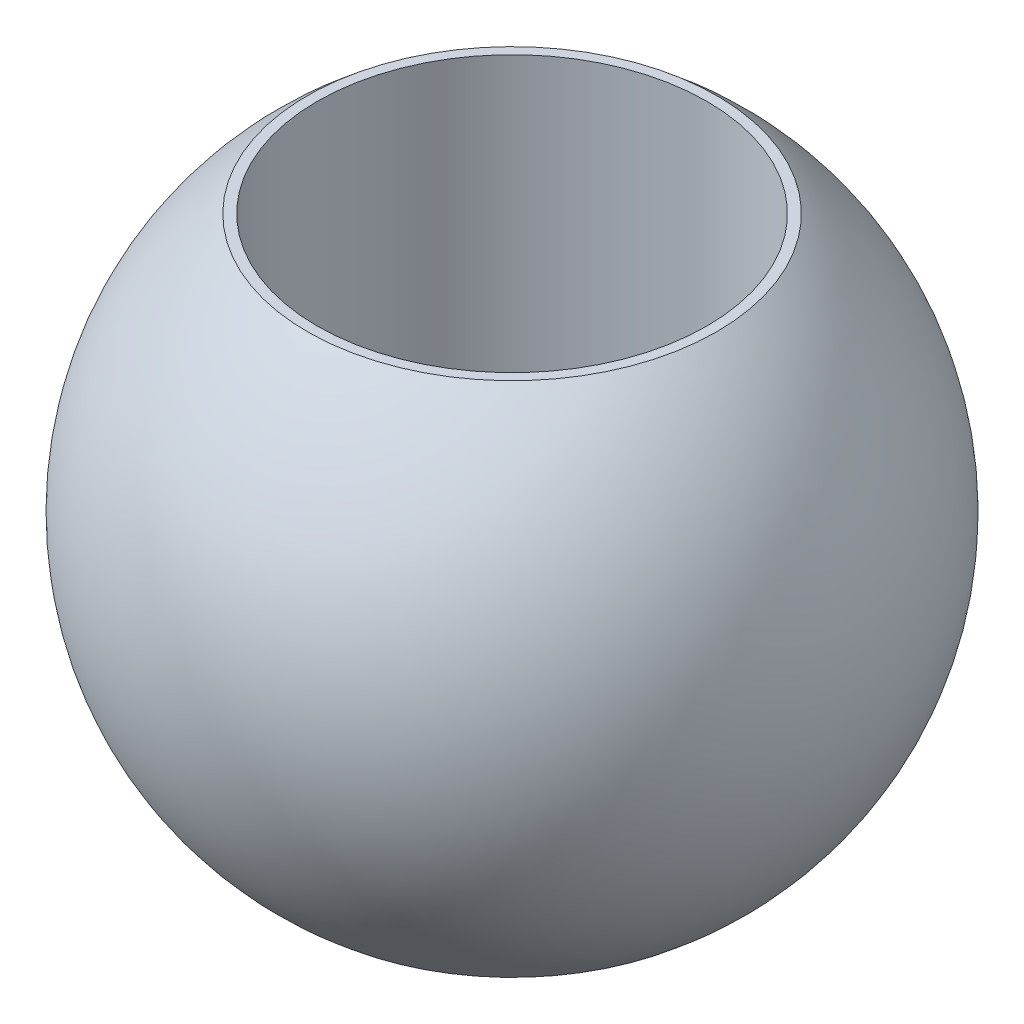
from build123d import *

# Parameters (mm, degrees)
CUT_EXTRUDE1_DEPTH      = 20.052558883
CUT_EXTRUDE1_DEPTH_BACK = 20.052558883
SKETCH2_R               = 6.5
CUT_EXTRUDE2_DEPTH      = 18.909494689
CUT_EXTRUDE2_DEPTH_BACK = 18.909494689
SKETCH3_W               = 22.753459083
SKETCH3_H               = 0.25
SKETCH3_W_2             = 23.945473889


with BuildPart() as part:
    # Sketch1 → Revolve1 (revolve)
    with BuildSketch(Plane.XY):
        with BuildLine():
            Line((0, 11), (0, -11))
            ThreePointArc((0, -11), (11, 0), (0, 11))
        make_face()
    revolve(axis=Axis((0, 11, 0), (0, -1, 0)))

    # Sketch2 → Cut-Extrude1 (cut, two sides: drawn at the far end of the back side and taken through both)
    with BuildSketch(Plane(origin=(0, 0, 0), x_dir=(1, 0, 0), z_dir=(0, 1, 0)).offset(-CUT_EXTRUDE1_DEPTH_BACK)):
        Circle(SKETCH2_R)
    extrude(amount=CUT_EXTRUDE1_DEPTH + CUT_EXTRUDE1_DEPTH_BACK, mode=Mode.SUBTRACT)

    # Sketch3 → Cut-Extrude2 (cut, two sides: drawn at the far end of the back side and taken through both)
    with BuildSketch(Plane.XY.offset(-CUT_EXTRUDE2_DEPTH_BACK)):
        with Locations((-0.087648148, 8.749119675)):
            Rectangle(SKETCH3_W, SKETCH3_H)
        with Locations((-0.227885183, -8.749119675)):
            Rectangle(SKETCH3_W_2, SKETCH3_H)
    extrude(amount=CUT_EXTRUDE2_DEPTH + CUT_EXTRUDE2_DEPTH_BACK, mode=Mode.SUBTRACT)


solid = part.part
